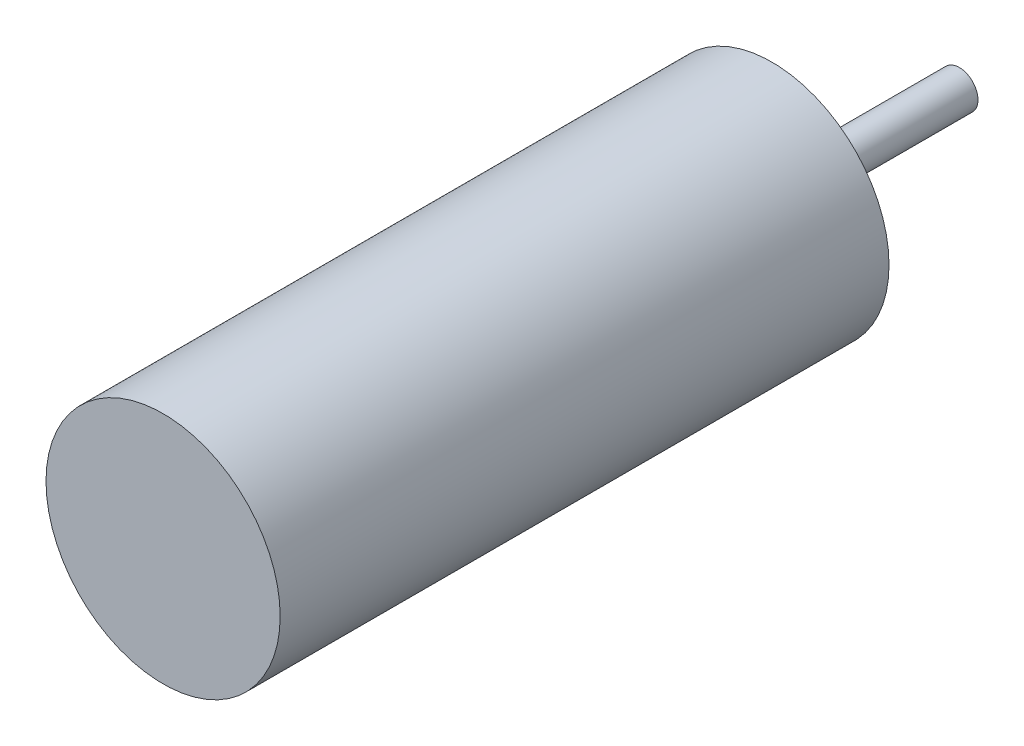
from build123d import *

# Parameters (mm, degrees)
SKETCH_1_R      = 2
EXTRUDE_1_DEPTH = 20
SKETCH_2_R      = 12.5
EXTRUDE_2_DEPTH = 65


with BuildPart() as part:
    # 草图1 → 凸台-拉伸1 (new body)
    with BuildSketch(Plane.XY):
        Circle(SKETCH_1_R)
    extrude(amount=EXTRUDE_1_DEPTH)

    # 草图2 → 凸台-拉伸2 (add)
    with BuildSketch(Plane.XY.offset(20)):
        Circle(SKETCH_2_R)
    extrude(amount=EXTRUDE_2_DEPTH)


solid = part.part
